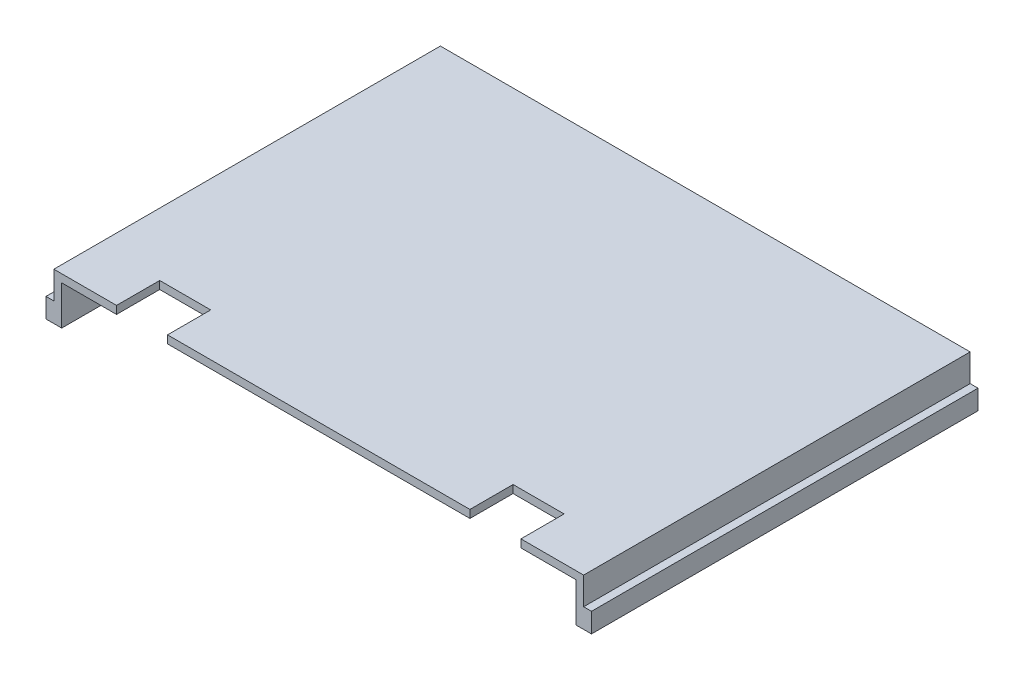
from build123d import *

# Parameters (mm, degrees)
SALIENTE_EXTRUIR1_DEPTH = 197
CROQUIS3_W              = 26
CROQUIS3_H              = 22
CORTAR_EXTRUIR1_DEPTH   = 299.793079874


with BuildPart() as part:
    # Croquis1 → Saliente-Extruir1 (new body)
    with BuildSketch(Plane.XY):
        Polygon((219.365853659, 10.012195122), (-50.634146341, 10.012195122), (-50.634146341, -3.987804878), (-54.634146341, -3.987804878), (-54.634146341, -13.987804878), (-49.344908275, -13.987804878), (-46.634146341, -13.987804878), (-46.634146341, -3.987804878), (-46.634146341, 6.012195122), (215.365853659, 6.012195122), (215.365853659, -3.987804878), (215.365853659, -13.987804878), (219.1357706, -13.987804878), (223.365853659, -13.987804878), (223.365853659, -3.987804878), (219.365853659, -3.987804878), align=None)
    extrude(amount=SALIENTE_EXTRUIR1_DEPTH)

    # Croquis3 → Cortar-Extruir1 (cut, through all)
    with BuildSketch(Plane(origin=(0, 10.012195122, 0), x_dir=(1, 0, 0), z_dir=(0, 1, 0))):
        with Locations((-5.684146341, -186)):
            Rectangle(CROQUIS3_W, CROQUIS3_H)
        with Locations((174.415853659, -186)):
            Rectangle(CROQUIS3_W, CROQUIS3_H)
    extrude(amount=-CORTAR_EXTRUIR1_DEPTH, mode=Mode.SUBTRACT)


solid = part.part
